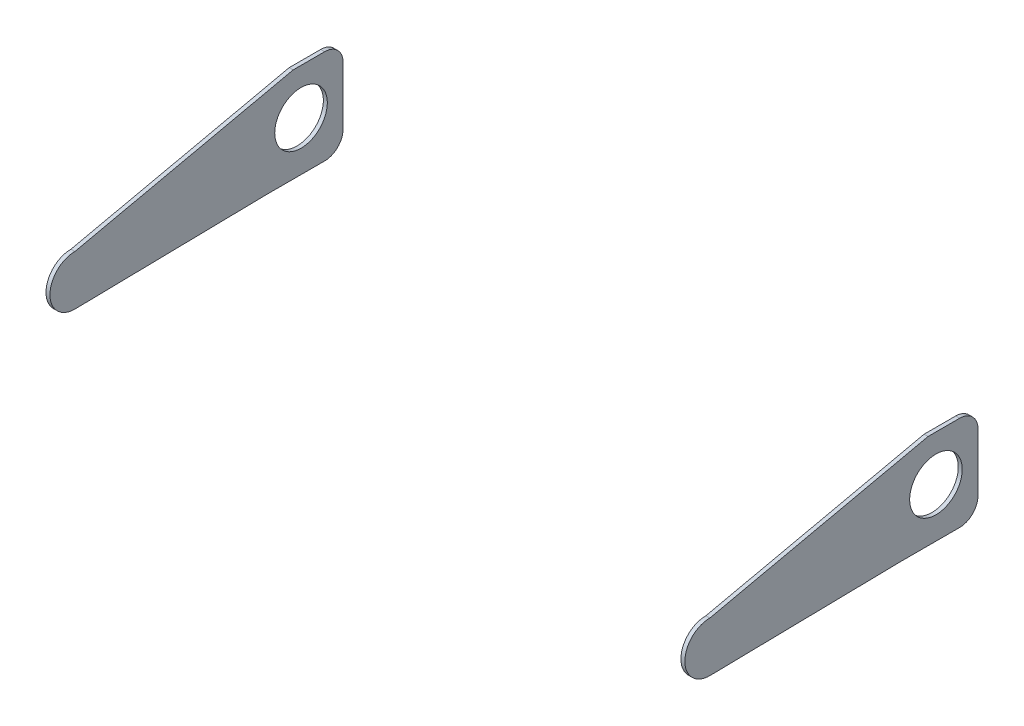
from build123d import *

# Parameters (mm, degrees)
SKETCH1_R           = 10
BOSS_EXTRUDE1_DEPTH = 1.5


with BuildPart() as part:
    # Sketch1 → Boss-Extrude1 (new body)
    with BuildSketch(Plane.ZY.offset(120)):
        with BuildLine():
            Line((11, -20), (-61.85712101, -18.7))
            Line((-61.85712101, -18.7), (-84, -18.7))
            ThreePointArc((-84, -18.7), (-88.949747468, -16.649747468), (-91, -11.7))
            Line((-91, -11.7), (-91, 10.3))
            ThreePointArc((-91, 10.3), (-88.949747468, 15.249747468), (-84, 17.3))
            Line((-84, 17.3), (-72, 17.3))
            Line((-72, 17.3), (11, -1))
            ThreePointArc((11, -1), (20.5, -10.5), (11, -20))
        make_face()
        with Locations((-75, 0)):
            Circle(SKETCH1_R, mode=Mode.SUBTRACT)
    extrude(amount=BOSS_EXTRUDE1_DEPTH)


with BuildPart() as body_2:
    # Mirror2: mirrored copy
    add(part.part.mirror(Plane(origin=(0, 0, 0), x_dir=(0, 0, 1), z_dir=(1, 0, 0))))


solid = Compound([part.part, body_2.part])
